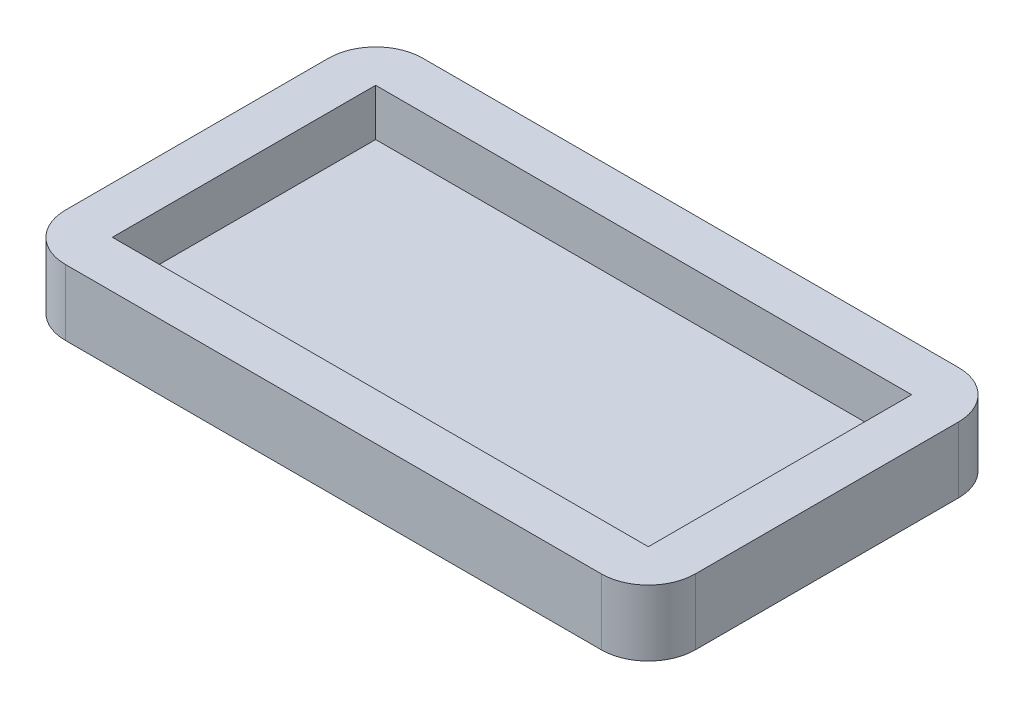
from build123d import *

# Parameters (mm, degrees)
BOSS_EXTRUDE2_DEPTH = 7
SKETCH3_W           = 57
SKETCH3_H           = 28
CUT_EXTRUDE2_DEPTH  = 5


with BuildPart() as part:
    # Sketch1 → Boss-Extrude2 (new body)
    with BuildSketch(Plane(origin=(0, 0, 0), x_dir=(1, 0, 0), z_dir=(0, 1, 0))):
        with BuildLine():
            Line((-43.625937993, 12.363093075), (-43.625937993, -15.636906925))
            ThreePointArc((-43.625937993, -15.636906925), (-42.161471899, -19.172440831), (-38.625937993, -20.636906925))
            Line((-38.625937993, -20.636906925), (18.374062007, -20.636906925))
            ThreePointArc((18.374062007, -20.636906925), (21.909595913, -19.172440831), (23.374062007, -15.636906925))
            Line((23.374062007, -15.636906925), (23.374062007, 12.363093075))
            ThreePointArc((23.374062007, 12.363093075), (21.909595913, 15.898626981), (18.374062007, 17.363093075))
            Line((18.374062007, 17.363093075), (-38.625937993, 17.363093075))
            ThreePointArc((-38.625937993, 17.363093075), (-42.161471899, 15.898626981), (-43.625937993, 12.363093075))
        make_face()
    extrude(amount=BOSS_EXTRUDE2_DEPTH)

    # Sketch3 → Cut-Extrude2 (cut)
    with BuildSketch(Plane(origin=(0, 7, 0), x_dir=(1, 0, 0), z_dir=(0, 1, 0))):
        with Locations((-10.125937993, -1.636906925)):
            Rectangle(SKETCH3_W, SKETCH3_H)
    extrude(amount=-CUT_EXTRUDE2_DEPTH, mode=Mode.SUBTRACT)


solid = part.part
